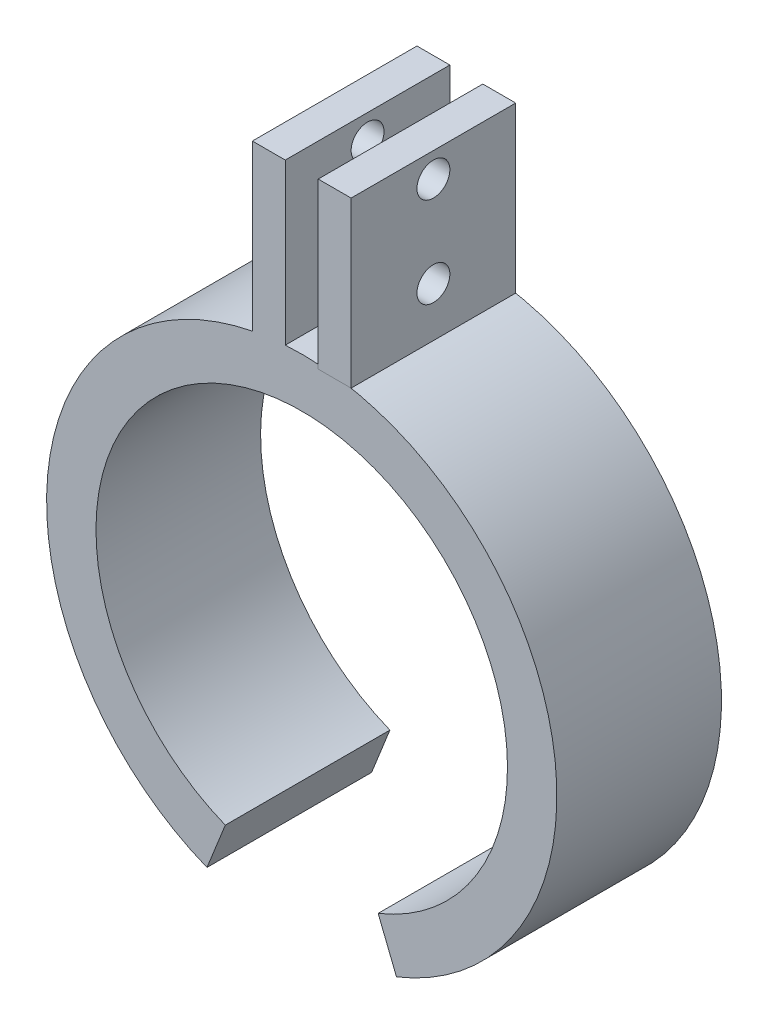
from build123d import *

# Parameters (mm, degrees)
EXTRUDE_THIN1_DEPTH     = 10
SKETCH3_W               = 2
SKETCH3_H               = 10
EXTRUDE_THIN2_DEPTH     = 10
SKETCH4_W               = 2
SKETCH4_H               = 10
EXTRUDE_THIN3_DEPTH     = 10
CUT_EXTRUDE1_DEPTH      = 33.827399021
CUT_EXTRUDE1_DEPTH_BACK = 33.827399021
SKETCH5_R               = 1


with BuildPart() as part:
    # Sketch1 → Extrude-Thin1 (new body)
    with BuildSketch(Plane.XY):
        with BuildLine():
            ThreePointArc((4.642383454, -11.605958636), (0, 12.5), (-4.642383454, -11.605958636))
            Line((-4.642383454, -11.605958636), (-5.756555483, -14.391388709))
            ThreePointArc((-5.756555483, -14.391388709), (0, 15.5), (5.756555483, -14.391388709))
            Line((5.756555483, -14.391388709), (4.642383454, -11.605958636))
        make_face()
    extrude(amount=EXTRUDE_THIN1_DEPTH)

    # Sketch3 → Extrude-Thin2 (add)
    with BuildSketch(Plane.XY.offset(10)):
        with Locations((-2, 20.206906326)):
            Rectangle(SKETCH3_W, SKETCH3_H)
    extrude(amount=-EXTRUDE_THIN2_DEPTH)


with BuildPart() as body_2:
    # Sketch4 → Extrude-Thin3 (new body)
    with BuildSketch(Plane.XY):
        with Locations((2, 20.206906326)):
            Rectangle(SKETCH4_W, SKETCH4_H)
    extrude(amount=EXTRUDE_THIN3_DEPTH)


with BuildPart() as cut_extrude1_tool:
    # Sketch5 → Cut-Extrude1 (new, two sides: drawn at the far end of the back side and taken through both)
    with BuildSketch(Plane.ZY.offset(3).offset(-CUT_EXTRUDE1_DEPTH_BACK)):
        with Locations((5, 23.706906326)):
            Circle(SKETCH5_R)
        with Locations((5, 18.206906326)):
            Circle(SKETCH5_R)
    extrude(amount=CUT_EXTRUDE1_DEPTH + CUT_EXTRUDE1_DEPTH_BACK)


with BuildPart() as part_1:
    add(part.part)

    # Cut-Extrude1: cut by cut_extrude1_tool
    add(cut_extrude1_tool.part, mode=Mode.SUBTRACT)


with BuildPart() as body_2_1:
    add(body_2.part)

    # Cut-Extrude1: cut by cut_extrude1_tool
    add(cut_extrude1_tool.part, mode=Mode.SUBTRACT)


solid = Compound([part_1.part, body_2_1.part])
